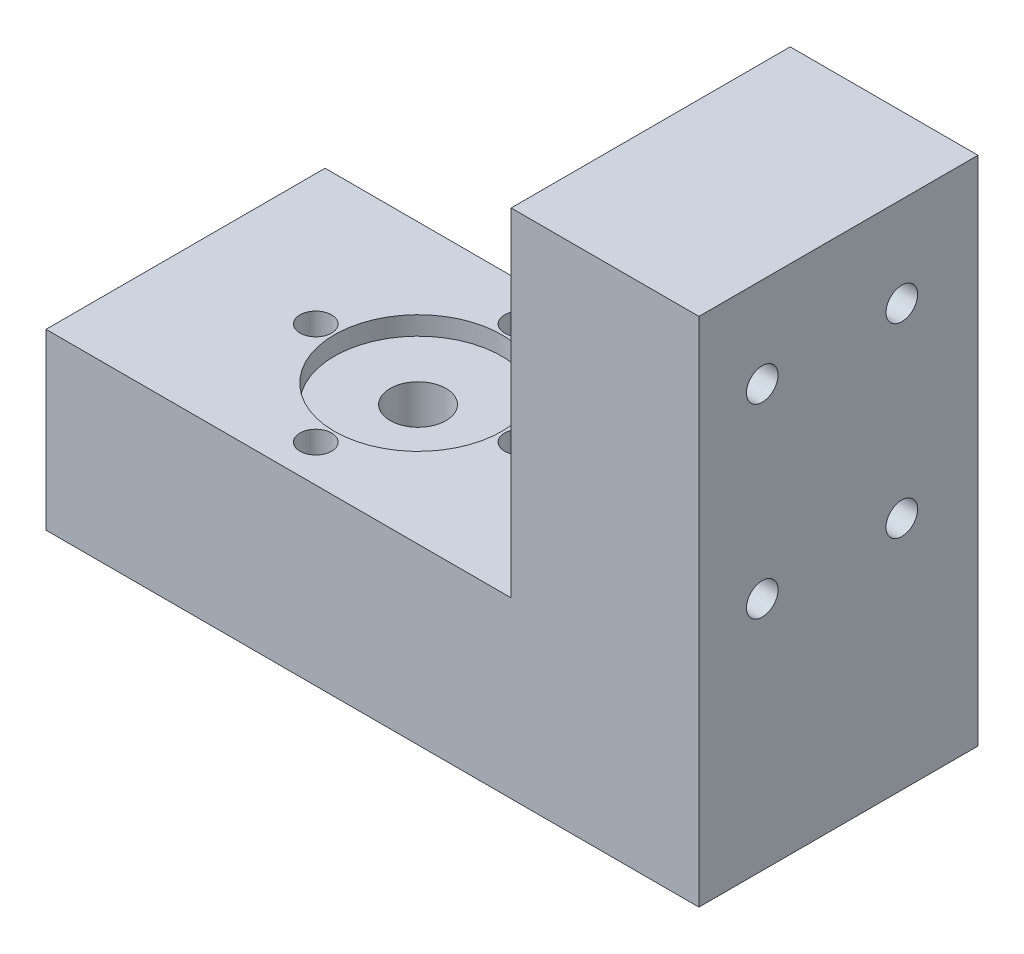
from build123d import *

# Parameters (mm, degrees)
BOSS_EXTRUDE1_DEPTH = 30
SKETCH2_R           = 9
CUT_EXTRUDE1_DEPTH  = 2
SKETCH4_R           = 1.7
SKETCH4_R_2         = 3
CUT_EXTRUDE2_DEPTH  = 85.524115494
SKETCH5_R           = 1.7
CUT_EXTRUDE3_DEPTH  = 95.083133983


with BuildPart() as part:
    # Sketch1 → Boss-Extrude1 (new body)
    with BuildSketch(Plane.XY):
        Polygon((0, 0), (0, 18.7), (50, 18.7), (50, 55), (70.19, 55), (70.19, 0), align=None)
    extrude(amount=-BOSS_EXTRUDE1_DEPTH)

    # Sketch2 → Cut-Extrude1 (cut)
    with BuildSketch(Plane(origin=(0, 18.7, 0), x_dir=(1, 0, 0), z_dir=(0, 1, 0))):
        with Locations(Location((25, 15, 0), (0, 0, 270))):
            Circle(SKETCH2_R)
    extrude(amount=-CUT_EXTRUDE1_DEPTH, mode=Mode.SUBTRACT)

    # Sketch4 → Cut-Extrude2 (cut, through all)
    with BuildSketch(Plane(origin=(0, 18.7, 0), x_dir=(1, 0, 0), z_dir=(0, 1, 0))):
        with Locations(Location((25, 26, 0), (0, 0, 270))):
            Circle(SKETCH4_R)
        with Locations(Location((36, 15, 0), (0, 0, 270))):
            Circle(SKETCH4_R)
        with Locations(Location((25, 4, 0), (0, 0, 270))):
            Circle(SKETCH4_R)
        with Locations(Location((14, 15, 0), (0, 0, 270))):
            Circle(SKETCH4_R)
        with Locations(Location((25, 15, 0), (0, 0, 270))):
            Circle(SKETCH4_R_2)
    extrude(amount=-CUT_EXTRUDE2_DEPTH, mode=Mode.SUBTRACT)

    # Sketch5 → Cut-Extrude3 (cut, through all)
    with BuildSketch(Plane(origin=(70.19, 0, 0), x_dir=(0, 0, -1), z_dir=(1, 0, 0))):
        with Locations(Location((6.810503995, 45.303971798, 0), (0, 0, 90))):
            Circle(SKETCH5_R)
        with Locations(Location((6.810503995, 25.303971798, 0), (0, 0, 90))):
            Circle(SKETCH5_R)
        with Locations(Location((21.810503995, 45.303971798, 0), (0, 0, 90))):
            Circle(SKETCH5_R)
        with Locations(Location((21.810503995, 25.303971798, 0), (0, 0, 90))):
            Circle(SKETCH5_R)
    extrude(amount=-CUT_EXTRUDE3_DEPTH, mode=Mode.SUBTRACT)


solid = part.part
